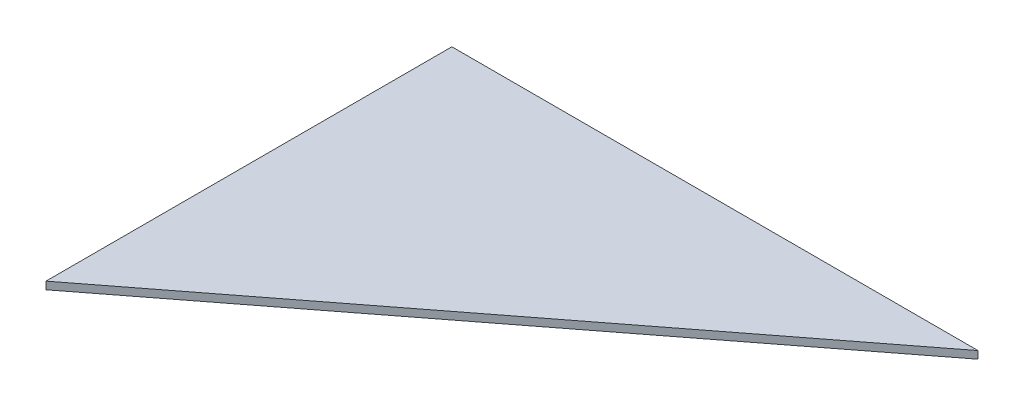
from build123d import *

# Parameters (mm, degrees)
BOSS_EXTRUDE1_DEPTH = 2.5


with BuildPart() as part:
    # Sketch1 → Boss-Extrude1 (new, symmetric)
    with BuildSketch(Plane(origin=(0, 0, 0), x_dir=(1, 0, 0), z_dir=(0, 1, 0))):
        Polygon((0, 0), (0, 270), (350, 270), align=None)
    extrude(amount=BOSS_EXTRUDE1_DEPTH, both=True)


solid = part.part
